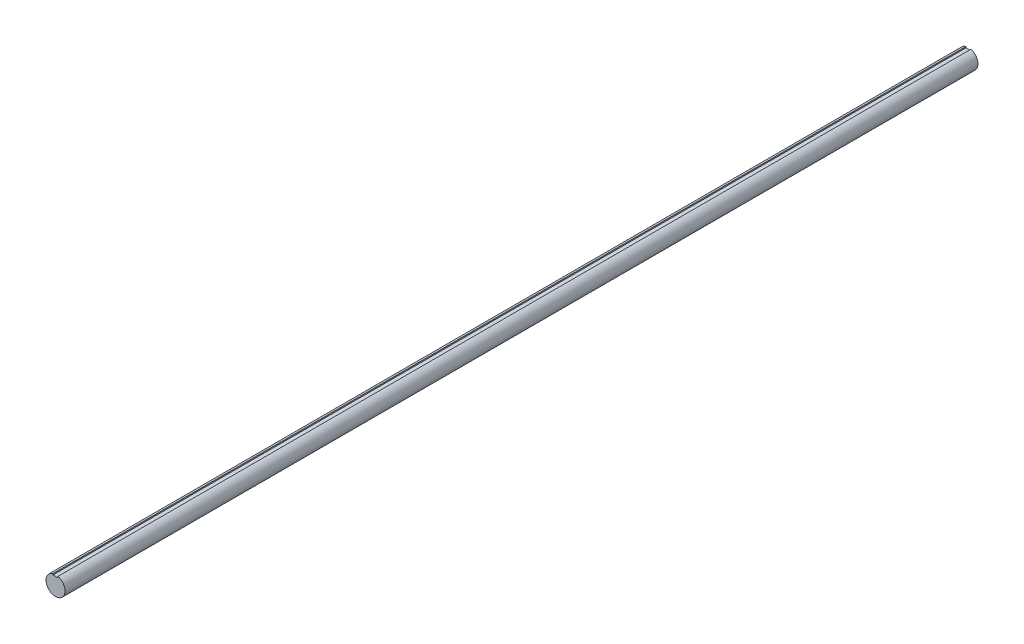
from build123d import *

# Parameters (mm, degrees)
BOSS_EXTRUDE1_DEPTH = 457.2


with BuildPart() as part:
    # Sketch1 → Boss-Extrude1 (new body)
    with BuildSketch(Plane.XY):
        with BuildLine():
            Line((-1.2192, 4.603798172), (-1.2192, 3.993341372))
            Line((-1.2192, 3.993341372), (1.2192, 3.993341372))
            Line((1.2192, 3.993341372), (1.2192, 4.603798172))
            ThreePointArc((1.2192, 4.603798172), (0, -4.7625), (-1.2192, 4.603798172))
        make_face()
    extrude(amount=BOSS_EXTRUDE1_DEPTH)


solid = part.part
